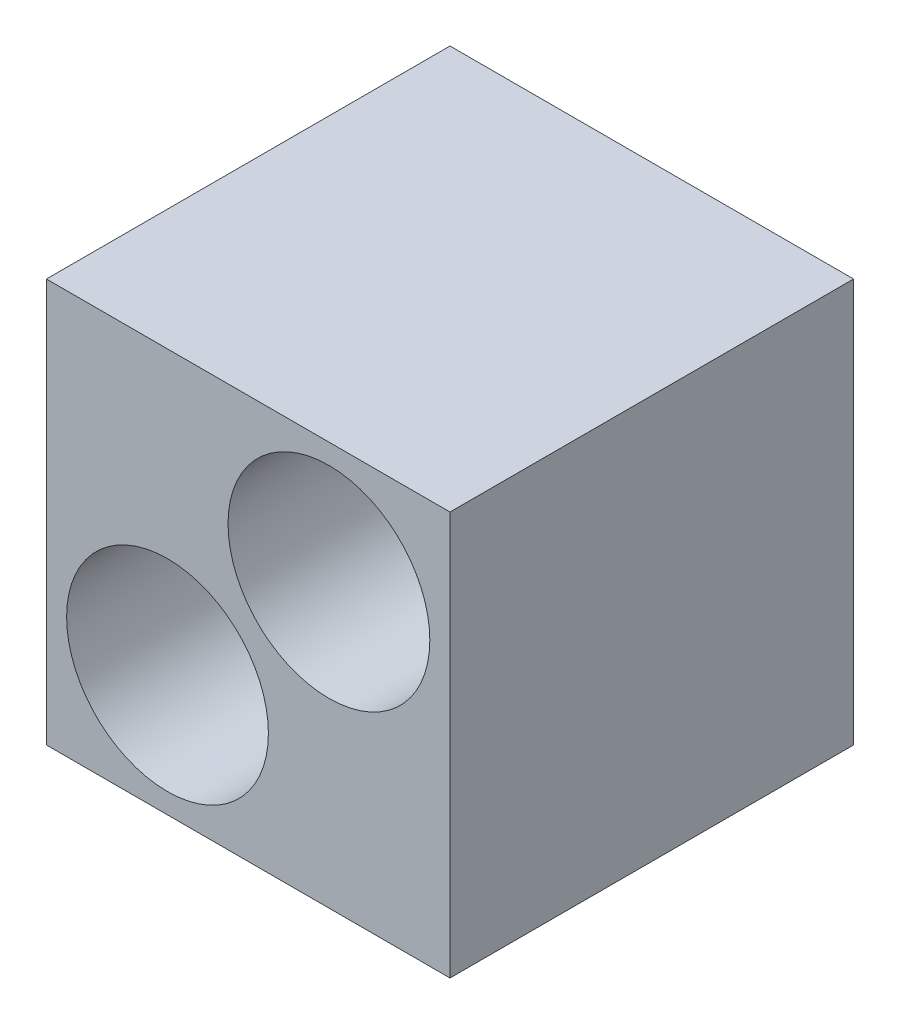
from build123d import *

# Parameters (mm, degrees)
SKETCH1_W           = 10
SKETCH1_H           = 10
BOSS_EXTRUDE1_DEPTH = 10
SKETCH2_R           = 2.5
CUT_EXTRUDE2_DEPTH  = 18.320508076


with BuildPart() as part:
    # Sketch1 → Boss-Extrude1 (new body)
    with BuildSketch(Plane.XY):
        with Locations((5, 5)):
            Rectangle(SKETCH1_W, SKETCH1_H)
    extrude(amount=BOSS_EXTRUDE1_DEPTH)

    # Sketch2 → Cut-Extrude2 (cut, through all)
    with BuildSketch(Plane.XY):
        with Locations((3, 3)):
            Circle(SKETCH2_R)
        with Locations((7, 7)):
            Circle(SKETCH2_R)
    extrude(amount=CUT_EXTRUDE2_DEPTH, mode=Mode.SUBTRACT)


solid = part.part
